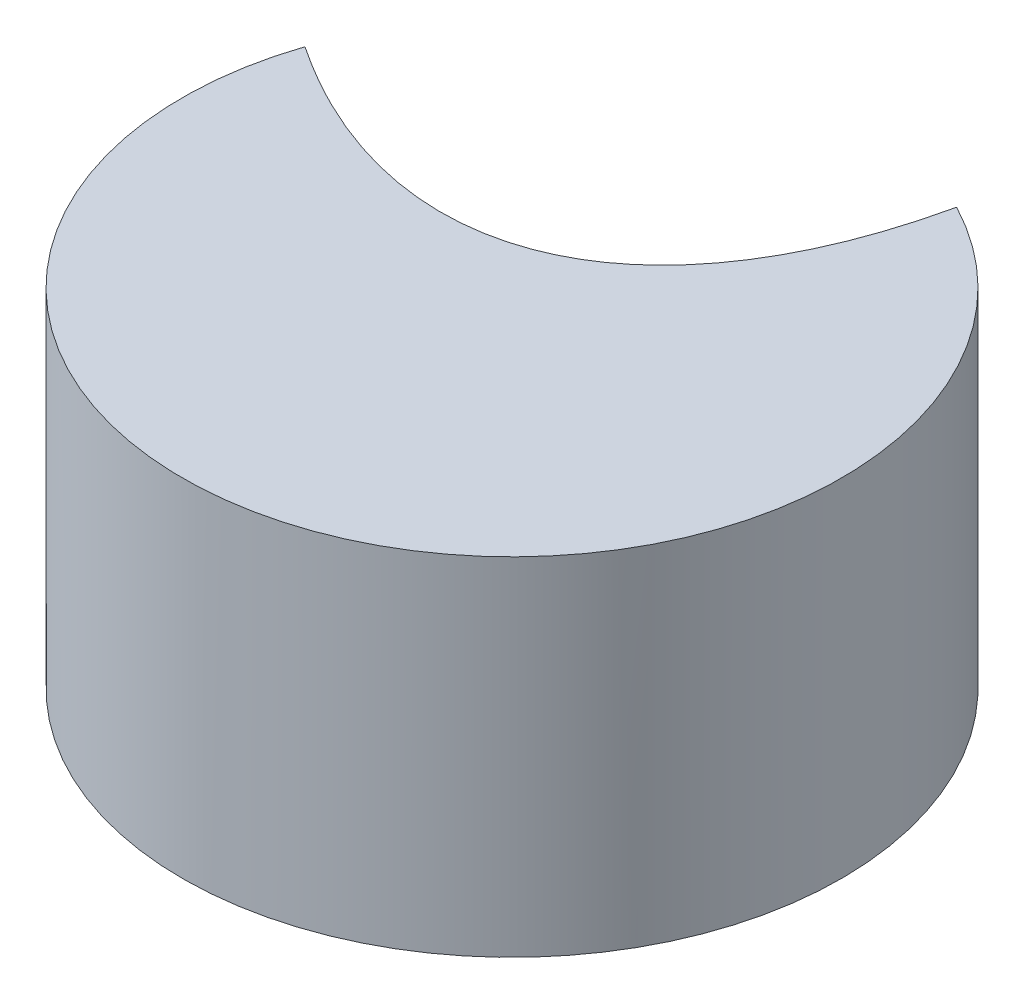
from build123d import *

# Parameters (mm, degrees)
KEYED_BACK_DEPTH   = 0.7
CUP_BLANK_SKETCH_R = 3.8
CUP_BLANK_DEPTH    = 3.3


with BuildPart() as part:
    # Keyed Back Sketch → Keyed Back (new body)
    with BuildSketch(Plane(origin=(0, -97, 0), x_dir=(-1, 0, 0), z_dir=(0, -1, 0))):
        with BuildLine():
            Line((59.811552234, -28.568114168), (55.771750258, -26.23573341))
            ThreePointArc((55.771750258, -26.23573341), (54.391651246, -33.290896534), (59.811552234, -28.568114168))
        make_face()
    extrude(amount=KEYED_BACK_DEPTH)

    # Cup Blank Sketch → Cup Blank (add)
    with BuildSketch(Plane(origin=(0, -97.7, 0), x_dir=(-1, 0, 0), z_dir=(0, -1, 0))):
        with Locations(Location((56.291651246, -30, 0), (0, 0, 22.136353638))):
            Circle(CUP_BLANK_SKETCH_R)
    extrude(amount=CUP_BLANK_DEPTH)

    # Spherical Bearing Seat profile → Spherical Bearing Seat (revolve, cut)
    with BuildSketch(Plane(origin=(0, -101, 0), x_dir=(-1, 0, 0), z_dir=(0, -1, 0))):
        with BuildLine():
            Line((56.291651246, -33.1), (56.291651246, -26.9))
            ThreePointArc((56.291651246, -26.9), (53.191651246, -30), (56.291651246, -33.1))
        make_face()
    revolve(axis=Axis((-56.291651246, -101, 20), (0, 0, 1)), mode=Mode.SUBTRACT)

    # Articulation Throat Sketch → Articulation Throat (revolve, cut)
    with BuildSketch(Plane(origin=(-75.19414337, -14.119516346, 20.509419779), x_dir=(-0.2544785459472912, -0.04778449262394895, -0.9658971539026421), z_dir=(0.9493062747008634, 0.17825517869277502, -0.2589260282064664))):
        Polygon((-9.825663304, -88.876600419), (-8.475389129, -90.738524062), (14.088996194, -82.675837476), (8.793573125, -75.373858667), align=None)
    revolve(axis=Axis((-53.148124615, -106.383086561, 37.819246728), (-0.3143526631246646, 0.5383086561091633, -0.781924672807028)), mode=Mode.SUBTRACT)


solid = part.part
